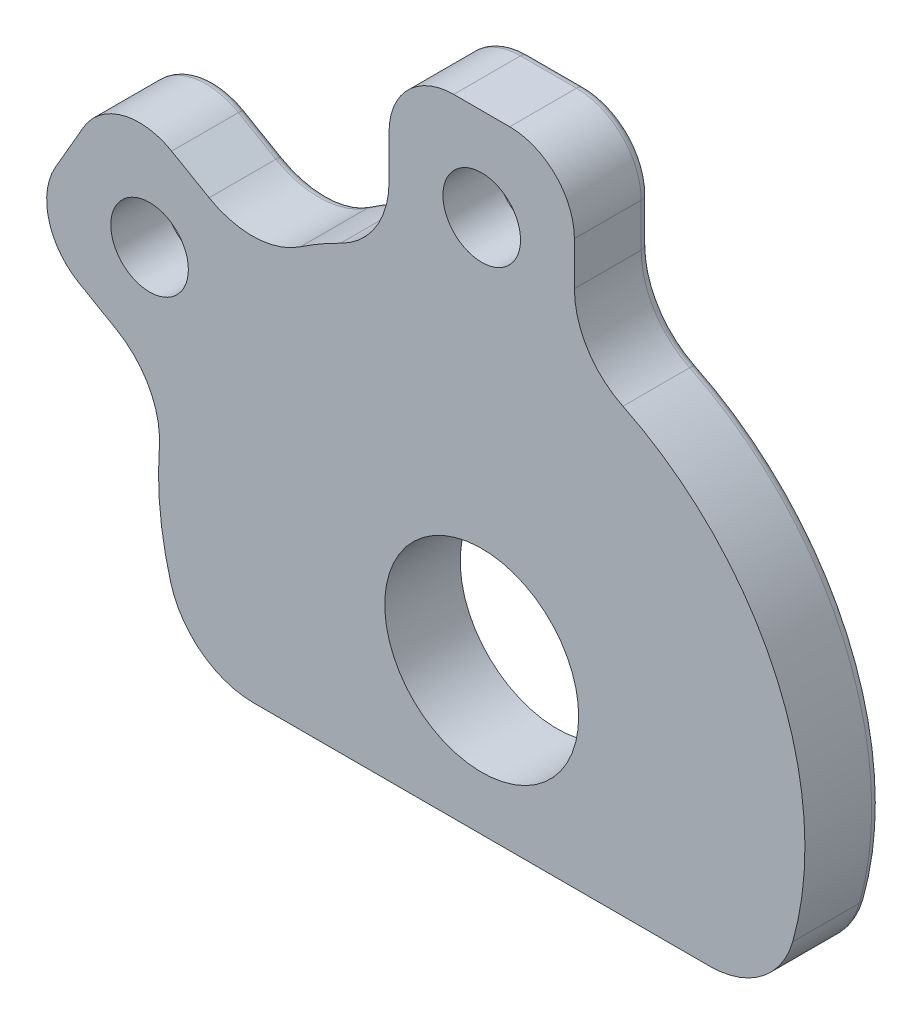
from build123d import *

# Parameters (mm, degrees)
SKETCH10_R          = 4.5
BOSS_EXTRUDE6_DEPTH = 1.75
SKETCH13_R          = 1.8
BOSS_EXTRUDE7_DEPTH = 1.75
FILLET1_R           = 4
CUT_EXTRUDE2_DEPTH  = 1.5
SKETCH16_R          = 3
CUT_EXTRUDE3_DEPTH  = 1
CHAMFER1_SIZE       = 0.5
FILLET2_R           = 0.4


with BuildPart() as part:
    # Sketch10 → Boss-Extrude6 (new, symmetric)
    with BuildSketch(Plane.XY):
        with BuildLine():
            Line((-13.266499161, -7), (13.266499161, -7))
            ThreePointArc((13.266499161, -7), (0, 15), (-13.266499161, -7))
        make_face()
        Circle(SKETCH10_R, mode=Mode.SUBTRACT)
    extrude(amount=BOSS_EXTRUDE6_DEPTH, both=True)

    # Sketch13 → Boss-Extrude7 (add, symmetric)
    # profile 1 of 2: a face of its own
    with BuildSketch(Plane.XY):
        with BuildLine():
            Line((-4.3, 14.370455803), (-4.3, 19.1))
            ThreePointArc((-4.3, 19.1), (-3.421320344, 21.221320344), (-1.3, 22.1))
            Line((-1.3, 22.1), (1.3, 22.1))
            ThreePointArc((1.3, 22.1), (3.421320344, 21.221320344), (4.3, 19.1))
            Line((4.3, 19.1), (4.3, 14.370455803))
            ThreePointArc((4.3, 14.370455803), (0, 15), (-4.3, 14.370455803))
        make_face()
        with Locations((0, 17.8)):
            Circle(SKETCH13_R, mode=Mode.SUBTRACT)
    # profile 2 of 2: a face of its own
    with BuildSketch(Plane.XY):
        with BuildLine():
            Line((-14.59517979, 3.461318665), (-18.691085212, 5.826090764))
            ThreePointArc((-18.691085212, 5.826090764), (-20.088862691, 7.64770984), (-19.789161424, 9.924166975))
            Line((-19.789161424, 9.924166975), (-18.489161424, 12.175833025))
            ThreePointArc((-18.489161424, 12.175833025), (-16.667542348, 13.573610504), (-14.391085212, 13.273909236))
            Line((-14.391085212, 13.273909236), (-10.29517979, 10.909137138))
            ThreePointArc((-10.29517979, 10.909137138), (-12.990381057, 7.5), (-14.59517979, 3.461318665))
        make_face()
        with Locations((-15.415252187, 8.9)):
            Circle(SKETCH13_R, mode=Mode.SUBTRACT)
    extrude(amount=BOSS_EXTRUDE7_DEPTH, both=True)

    # Fillet1
    fillet1_edges = [part.edges().sort_by_distance(p)[0] for p in [
        (-4.3, 14.370455803, 0),
        (4.3, 14.370455803, 0),
        (-14.59517979, 3.461318665, 0),
        (-10.29517979, 10.909137138, 0),
        (13.266499161, -7, 0),
        (-13.266499161, -7, 0),
    ]]
    fillet(fillet1_edges, radius=FILLET1_R)

    # Sketch15 → Cut-Extrude2 (cut)
    with BuildSketch(Plane(origin=(0, 0, -1.75), x_dir=(-1, 0, 0), z_dir=(0, 0, -1))):
        with BuildLine():
            Line((-3.711309131, 8.453153894), (-7.336540279, 6.762680847))
            ThreePointArc((-7.336540279, 6.762680847), (-7.595077459, 6.480537025), (-7.578385042, 6.098217822))
            Line((-7.578385042, 6.098217822), (-6.944457649, 4.738756142))
            ThreePointArc((-6.944457649, 4.738756142), (-6.662313827, 4.480218962), (-6.279994625, 4.496911379))
            Line((-6.279994625, 4.496911379), (-2.654763477, 6.187384426))
            ThreePointArc((-2.654763477, 6.187384426), (-2.396226297, 6.469528248), (-2.412918714, 6.85184745))
            Line((-2.412918714, 6.85184745), (-3.046846106, 8.211309131))
            ThreePointArc((-3.046846106, 8.211309131), (-3.328989928, 8.46984631), (-3.711309131, 8.453153894))
        make_face()
        with BuildLine():
            Line((6.944457649, 4.738756142), (7.578385042, 6.098217822))
            ThreePointArc((7.578385042, 6.098217822), (7.595077459, 6.480537025), (7.336540279, 6.762680847))
            Line((7.336540279, 6.762680847), (3.711309131, 8.453153894))
            ThreePointArc((3.711309131, 8.453153894), (3.328989928, 8.46984631), (3.046846106, 8.211309131))
            Line((3.046846106, 8.211309131), (2.412918714, 6.85184745))
            ThreePointArc((2.412918714, 6.85184745), (2.396226297, 6.469528248), (2.654763477, 6.187384426))
            Line((2.654763477, 6.187384426), (6.279994625, 4.496911379))
            ThreePointArc((6.279994625, 4.496911379), (6.662313827, 4.480218962), (6.944457649, 4.738756142))
        make_face()
    extrude(amount=-CUT_EXTRUDE2_DEPTH, mode=Mode.SUBTRACT)

    # Sketch16 → Cut-Extrude3 (cut)
    with BuildSketch(Plane(origin=(0, 0, -1.75), x_dir=(-1, 0, 0), z_dir=(0, 0, -1))):
        with Locations((0, 17.8)):
            Circle(SKETCH16_R)
        with Locations((15.415252187, 8.9)):
            Circle(SKETCH16_R)
    extrude(amount=-CUT_EXTRUDE3_DEPTH, mode=Mode.SUBTRACT)

    # Chamfer1
    chamfer1_edges = [part.edges().sort_by_distance(p)[0] for p in [
        (3, 17.8, -1.75),
        (-12.415252187, 8.9, -1.75),
    ]]
    chamfer(chamfer1_edges, length=CHAMFER1_SIZE)

    # Fillet2
    fillet2_edges = [part.edges().sort_by_distance(p)[0] for p in [
        (3.421320344, 21.221320344, -1.75),
        (0, 22.1, -1.75),
        (-3.421320344, 21.221320344, -1.75),
        (-4.3, 18.09561291, -1.75),
        (-16.667542348, 13.573610504, -1.75),
        (-19.139161424, 11.05, -1.75),
        (-20.088862691, 7.64770984, -1.75),
        (-17.821260477, 5.323897219, -1.75),
        (-14.921492219, -1.5326676, -1.75),
        (4.3, 18.09561291, -1.75),
        (13.688725123, 6.133417032, -1.75),
        (-13.521260477, 12.771715691, -1.75),
        (-7.5, 12.990381057, -1.75),
        (0, -7, -1.75),
        (-12.995096001, -6.190896141, -1.75),
        (12.995096001, -6.190896141, -1.75),
        (-15.418049964, 3.232484708, -1.75),
        (4.909611108, 14.9686653, -1.75),
        (-10.508438857, 11.736180592, -1.75),
        (-4.909611108, 14.9686653, -1.75),
    ]]
    fillet(fillet2_edges, radius=FILLET2_R)


solid = part.part
